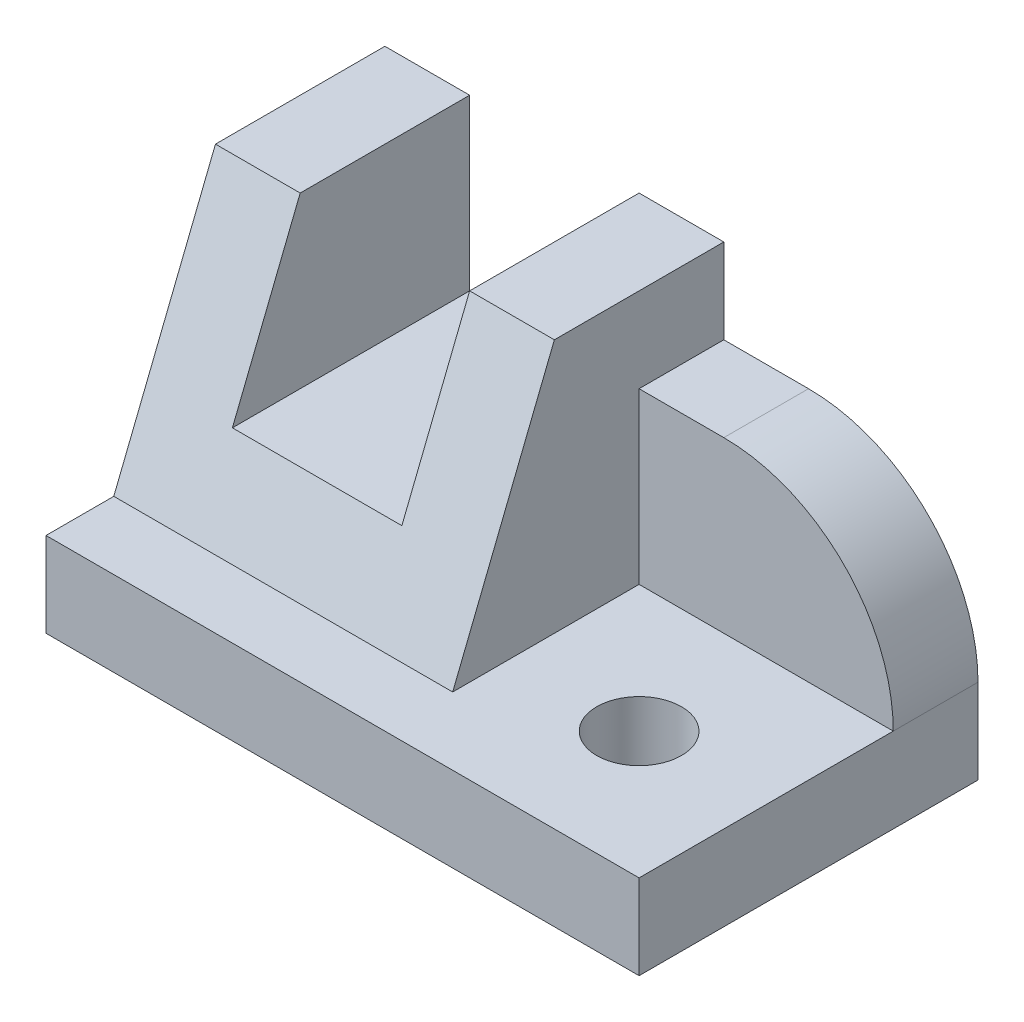
from build123d import *

# Parameters (mm, degrees)
BOSS_EXTRUDE1_DEPTH            = 40
SKETCH2_W                      = 40
SKETCH2_H                      = 30
BOSS_EXTRUDE2_DEPTH            = 20
BOSS_EXTRUDE3_DEPTH            = 30
CUT_EXTRUDE1_DEPTH             = 30
SKETCH5_W                      = 70
SKETCH5_H                      = 40
BOSS_EXTRUDE4_DEPTH            = 10
SKETCH6_W                      = 20
SKETCH6_H                      = 20
CUT_EXTRUDE2_DEPTH             = 91
F_10_0_10_DIAMETER_HOLE1_D     = 10
F_10_0_10_DIAMETER_HOLE1_DEPTH = 40
FILLET1_R                      = 20


with BuildPart() as part:
    # Sketch1 → Boss-Extrude1 (new body)
    with BuildSketch(Plane(origin=(0, 0, 0), x_dir=(0, -1, 0), z_dir=(-1, 0, 0))):
        Polygon((-10, -8), (-40, -20), (-10, -20), align=None)
    extrude(amount=-BOSS_EXTRUDE1_DEPTH)

    # Sketch2 → Boss-Extrude2 (add)
    with BuildSketch(Plane(origin=(0, 0, -20), x_dir=(-1, 0, 0), z_dir=(0, 0, -1))):
        with Locations((-20, 25)):
            Rectangle(SKETCH2_W, SKETCH2_H)
    extrude(amount=BOSS_EXTRUDE2_DEPTH)

    # Sketch3 → Boss-Extrude3 (add)
    with BuildSketch(Plane(origin=(40, 0, 0), x_dir=(0, 0, -1), z_dir=(1, 0, 0))):
        Polygon((40, 10), (0, 10), (20, 40), (40, 40), align=None)
    extrude(amount=BOSS_EXTRUDE3_DEPTH)

    # Sketch4 → Cut-Extrude1 (cut)
    with BuildSketch(Plane(origin=(70, 0, 0), x_dir=(0, 0, -1), z_dir=(1, 0, 0))):
        Polygon((20, 40), (0, 10), (30, 10), (30, 30), (40, 30), (40, 40), align=None)
    extrude(amount=-CUT_EXTRUDE1_DEPTH, mode=Mode.SUBTRACT)

    # Sketch5 → Boss-Extrude4 (add)
    with BuildSketch(Plane.XZ.offset(-10)):
        with Locations((35, -20)):
            Rectangle(SKETCH5_W, SKETCH5_H)
    extrude(amount=BOSS_EXTRUDE4_DEPTH)

    # Sketch6 → Cut-Extrude2 (cut, through all)
    with BuildSketch(Plane(origin=(0, 0, -40), x_dir=(-1, 0, 0), z_dir=(0, 0, -1))):
        with Locations((-20, 30)):
            Rectangle(SKETCH6_W, SKETCH6_H)
    extrude(amount=-CUT_EXTRUDE2_DEPTH, mode=Mode.SUBTRACT)

    # Ø10.0 (10) Diameter Hole1
    with Locations(Plane(origin=(0, 0, 0), x_dir=(-1, 0, 0), z_dir=(0, -1, 0))):
        with Locations((-55, 15)):
            Hole(F_10_0_10_DIAMETER_HOLE1_D / 2, depth=F_10_0_10_DIAMETER_HOLE1_DEPTH)

    # Fillet1
    fillet1_edges = [part.edges().sort_by_distance(p)[0] for p in [
        (70, 30, -35),
    ]]
    fillet(fillet1_edges, radius=FILLET1_R)


solid = part.part
